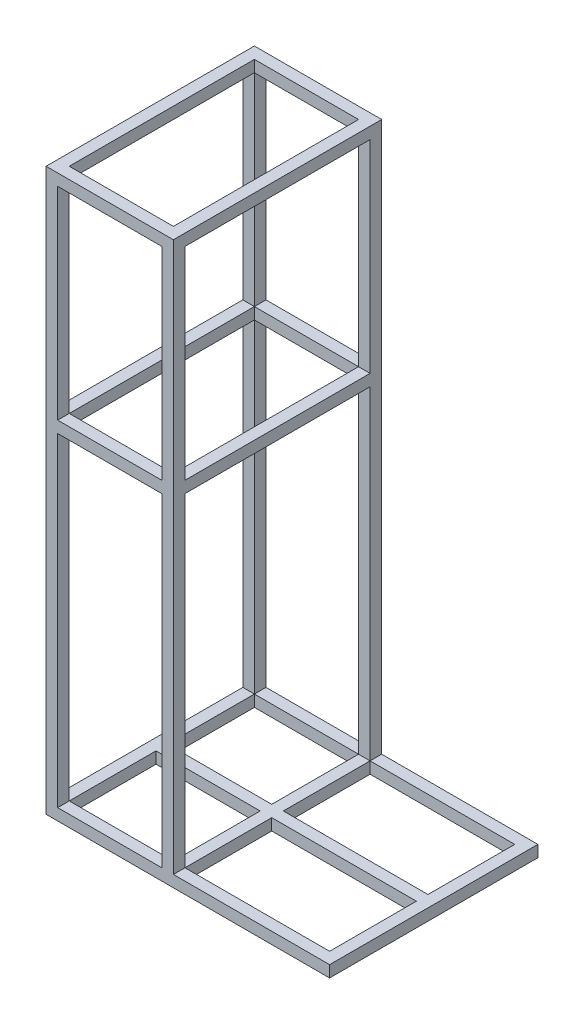
from build123d import *

# Parameters (mm, degrees)
SKETCH1_W             = 25.4
SKETCH1_H             = 25.4
BOSS_EXTRUDE1_DEPTH   = 1231.9
BOSS_EXTRUDE1_2_DEPTH = 1231.9
BOSS_EXTRUDE1_3_DEPTH = 1231.9
BOSS_EXTRUDE1_4_DEPTH = 1231.9
SKETCH2_W             = 25.4
SKETCH2_H             = 25.4
BOSS_EXTRUDE2_DEPTH   = 596.9
SKETCH3_W             = 25.4
SKETCH3_H             = 25.4
BOSS_EXTRUDE3_DEPTH   = 406.4
SKETCH4_W             = 25.4
SKETCH4_H             = 25.4
BOSS_EXTRUDE4_DEPTH   = 406.4
BOSS_EXTRUDE5_REACH   = 1445.225
SKETCH5_W             = 25.4
SKETCH5_H             = 25.4


with BuildPart() as part:
    # Sketch1 → Boss-Extrude1 (new body)
    with BuildSketch(Plane(origin=(0, 0, 0), x_dir=(1, 0, 0), z_dir=(0, 1, 0))):
        with Locations((-12.7, 12.7)):
            Rectangle(SKETCH1_W, SKETCH1_H)
    extrude(amount=BOSS_EXTRUDE1_DEPTH)



with BuildPart() as body_2:
    # Sketch1 → Boss-Extrude1 2 (new body)
    with BuildSketch(Plane(origin=(0, 0, 0), x_dir=(1, 0, 0), z_dir=(0, 1, 0))):
        with Locations((-12.7, 444.5)):
            Rectangle(SKETCH1_W, SKETCH1_H)
    extrude(amount=BOSS_EXTRUDE1_2_DEPTH)


with BuildPart() as body_3:
    # Sketch1 → Boss-Extrude1 3 (new body)
    with BuildSketch(Plane(origin=(0, 0, 0), x_dir=(1, 0, 0), z_dir=(0, 1, 0))):
        with Locations((241.3, 12.7)):
            Rectangle(SKETCH1_W, SKETCH1_H)
    extrude(amount=BOSS_EXTRUDE1_3_DEPTH)


with BuildPart() as body_4:
    # Sketch1 → Boss-Extrude1 4 (new body)
    with BuildSketch(Plane(origin=(0, 0, 0), x_dir=(1, 0, 0), z_dir=(0, 1, 0))):
        with Locations((241.3, 444.5)):
            Rectangle(SKETCH1_W, SKETCH1_H)
    extrude(amount=BOSS_EXTRUDE1_4_DEPTH)


with BuildPart() as part_1:
    add(part.part)

    add(body_2.part)  # Boss-Extrude2 merges body 2

    add(body_3.part)  # Boss-Extrude2 merges body 3

    add(body_4.part)  # Boss-Extrude2 merges body 4
    # Sketch2 → Boss-Extrude2 (add)
    with BuildSketch(Plane(origin=(0, 0, 0), x_dir=(0, 0, -1), z_dir=(1, 0, 0))):
        with Locations((12.7, 12.7)):
            Rectangle(SKETCH2_W, SKETCH2_H)
        with Locations((444.5, 12.7)):
            Rectangle(SKETCH2_W, SKETCH2_H)
        with Locations((228.6, 12.7)):
            Rectangle(SKETCH2_W, SKETCH2_H)
    extrude(amount=BOSS_EXTRUDE2_DEPTH)

    # Sketch3 → Boss-Extrude3 (add)
    with BuildSketch(Plane(origin=(0, 0, -25.4), x_dir=(-1, 0, 0), z_dir=(0, 0, -1))):
        with Locations((12.7, 12.7)):
            Rectangle(SKETCH3_W, SKETCH3_H)
        with Locations((-584.2, 12.7)):
            Rectangle(SKETCH3_W, SKETCH3_H)
    extrude(amount=BOSS_EXTRUDE3_DEPTH)

    # Sketch4 → Boss-Extrude4 (add)
    with BuildSketch(Plane.XY.offset(-431.8)):
        with Locations((241.3, 12.7)):
            Rectangle(SKETCH4_W, SKETCH4_H)
        with Locations((241.3, 1219.2)):
            Rectangle(SKETCH4_W, SKETCH4_H)
        with Locations((-12.7, 1219.2)):
            Rectangle(SKETCH4_W, SKETCH4_H)
        with Locations((241.3, 749.3)):
            Rectangle(SKETCH4_W, SKETCH4_H)
        with Locations((-12.7, 749.3)):
            Rectangle(SKETCH4_W, SKETCH4_H)
    extrude(amount=BOSS_EXTRUDE4_DEPTH)

    # Sketch5 → Boss-Extrude5 (add, up to next)
    with BuildSketch(Plane(origin=(0, 0, 0), x_dir=(0, 0, -1), z_dir=(1, 0, 0)), mode=Mode.PRIVATE) as boss_extrude5_sk1:
        with Locations((12.7, 1219.2)):
            Rectangle(SKETCH5_W, SKETCH5_H)
    boss_extrude5_tool1 = extrude(boss_extrude5_sk1.sketch, amount=BOSS_EXTRUDE5_REACH, mode=Mode.PRIVATE) - part_1.part
    # Sketch5 → Boss-Extrude5 (add, up to next)
    with BuildSketch(Plane(origin=(0, 0, 0), x_dir=(0, 0, -1), z_dir=(1, 0, 0)), mode=Mode.PRIVATE) as boss_extrude5_sk2:
        with Locations((444.5, 1219.2)):
            Rectangle(SKETCH5_W, SKETCH5_H)
    boss_extrude5_tool2 = extrude(boss_extrude5_sk2.sketch, amount=BOSS_EXTRUDE5_REACH, mode=Mode.PRIVATE) - part_1.part
    # Sketch5 → Boss-Extrude5 (add, up to next)
    with BuildSketch(Plane(origin=(0, 0, 0), x_dir=(0, 0, -1), z_dir=(1, 0, 0)), mode=Mode.PRIVATE) as boss_extrude5_sk3:
        with Locations((444.5, 749.3)):
            Rectangle(SKETCH5_W, SKETCH5_H)
    boss_extrude5_tool3 = extrude(boss_extrude5_sk3.sketch, amount=BOSS_EXTRUDE5_REACH, mode=Mode.PRIVATE) - part_1.part
    # Sketch5 → Boss-Extrude5 (add, up to next)
    with BuildSketch(Plane(origin=(0, 0, 0), x_dir=(0, 0, -1), z_dir=(1, 0, 0)), mode=Mode.PRIVATE) as boss_extrude5_sk4:
        with Locations((12.7, 749.3)):
            Rectangle(SKETCH5_W, SKETCH5_H)
    boss_extrude5_tool4 = extrude(boss_extrude5_sk4.sketch, amount=BOSS_EXTRUDE5_REACH, mode=Mode.PRIVATE) - part_1.part
    add(boss_extrude5_tool1.solids().sort_by_distance((0, 1219.2, -12.7))[0])
    add(boss_extrude5_tool2.solids().sort_by_distance((0, 1219.2, -444.5))[0])
    add(boss_extrude5_tool3.solids().sort_by_distance((0, 749.3, -444.5))[0])
    add(boss_extrude5_tool4.solids().sort_by_distance((0, 749.3, -12.7))[0])


solid = part_1.part
